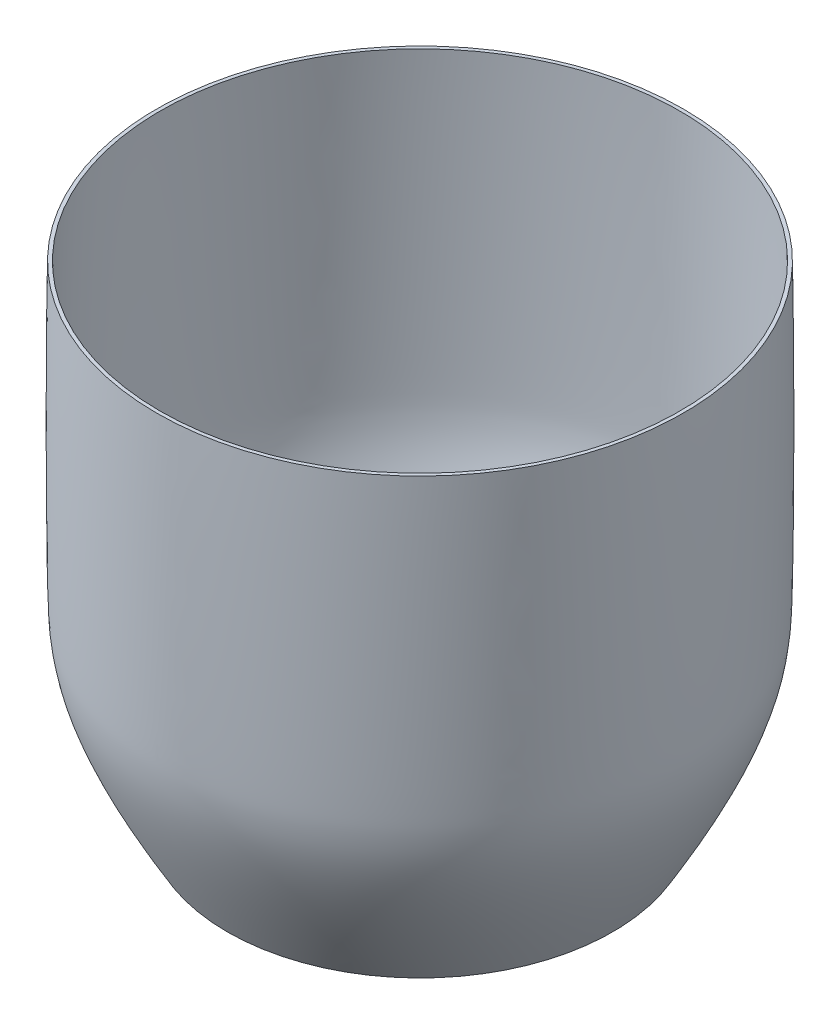
from build123d import *

# Parameters (mm, degrees)
CUT_EXTRUDE1_DEPTH      = 186.473263261
CUT_EXTRUDE1_DEPTH_BACK = 186.473263261
SKETCH2_W               = 282.331602344
SKETCH2_H               = 135.803570739


with BuildPart() as part:
    # Sketch1 → Revolve1 (revolve)
    with BuildSketch(Plane.XY, mode=Mode.PRIVATE) as revolve1_sk:
        with BuildLine():
            Line((55, -150), (55.864024026, -150.503450576))
            add(Edge.make_bspline(
                [(45.00654715, 0.114242876), (45.06482757, 0.621047776), (45.18851775, 1.644460519), (45.449476223, 3.604534474), (45.807109076, 5.951302739), (46.282175802, 8.587277687), (46.974586794, 11.87284442), (47.944891454, 15.556110412), (49.260798878, 19.327399197), (50.71426174, 22.479202135), (52.822531276, 25.890737105), (55.762438214, 28.752400148), (59.775616352, 29.944703091), (63.735411013, 28.855964426), (67.272310325, 25.993185479), (70.384049491, 21.659198301), (72.968670827, 16.049508725), (74.908223827, 9.354436921), (76.006528055, 1.781881661), (76.311133894, -6.501339013), (76.445466907, -15.82130644), (76.559676902, -26.07226948), (76.624078217, -36.850121223), (76.659503219, -51.472599903), (76.621324876, -65.762266047), (76.523261527, -78.31217141), (76.422750358, -86.503967208), (76.319341067, -92.017255526), (76.225951493, -95.474691226), (76.126991356, -98.213222787), (75.980332868, -100.516841803), (75.726389583, -102.804562872), (75.32570475, -105.691817603), (74.621297046, -109.202041189), (73.473579764, -113.466672248), (71.73946293, -118.597826519), (69.687111884, -123.698544356), (67.609264094, -128.335514056), (65.814911511, -132.10705832), (63.766745899, -136.187722813), (61.833022305, -139.85953744), (60.141797292, -142.965951038), (58.796671742, -145.386184345), (57.382072923, -147.882500868), (56.367441397, -149.639483537), (55.864024026, -150.503450576)],
                knots=[0, 0, 0, 0, 0.00390625, 0.0078125, 0.015625, 0.0234375, 0.03125, 0.046875, 0.0625, 0.078125, 0.09375, 0.125, 0.15625, 0.1875, 0.21875, 0.25, 0.28125, 0.3125, 0.34375, 0.375, 0.40625, 0.4375, 0.46875, 0.5, 0.5625, 0.59375, 0.625, 0.65625, 0.671875, 0.6875, 0.71875, 0.75, 0.78125, 0.8125, 0.84375, 0.875, 0.90625, 0.921875, 0.9375, 0.953125, 0.96875, 0.9765625, 0.984375, 0.9921875, 1, 1, 1, 1], degree=3))
            Line((45.00654715, 0.114242876), (46, 0))
            add(Edge.make_bspline(
                [(46, 0), (50.9933971, 43.422441349), (74.419231037, 29.066702517), (75.887608065, -30.170664842), (75.613452989, -93.029990368), (74.522170097, -105.896749327), (71.853744098, -121.075532478), (55, -150)],
                knots=[0, 0, 0, 0, 0.332423256, 0.386421074, 0.677937349, 0.742939195, 1, 1, 1, 1], degree=3))
        make_face()
    revolve(revolve1_sk.sketch.rotate(Axis((0, 0, 0), (0, -1, 0)), 90), axis=Axis((0, 0, 0), (0, -1, 0)))

    # Sketch2 → Cut-Extrude1 (cut, two sides: drawn at the far end of the back side and taken through both)
    with BuildSketch(Plane.XY.offset(-CUT_EXTRUDE1_DEPTH_BACK)):
        with Locations((10.151002348, 57.90178537)):
            Rectangle(SKETCH2_W, SKETCH2_H)
    extrude(amount=CUT_EXTRUDE1_DEPTH + CUT_EXTRUDE1_DEPTH_BACK, mode=Mode.SUBTRACT)


solid = part.part
